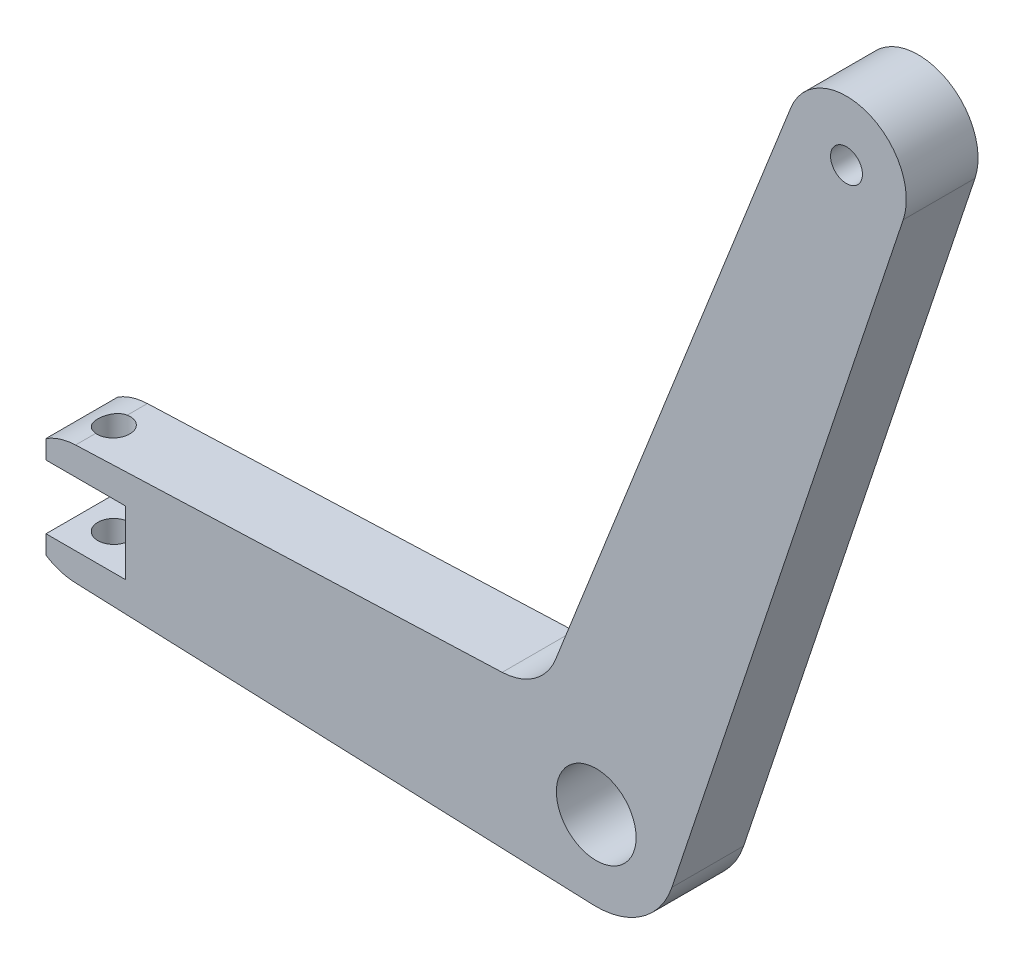
from build123d import *

# Parameters (mm, degrees)
EXTRUDE_1_DEPTH     = 18
SKETCH_3_R          = 10
SKETCH_3_R_2        = 4
CUT_EXTRUDE_1_DEPTH = 18
SKETCH_4_R          = 4
CUT_EXTRUDE_2_DEPTH = 20
CUT_EXTRUDE_START   = 12
SKETCH_5_W          = 18
SKETCH_5_H          = 16
CUT_EXTRUDE_3_DEPTH = 28
CUT_EXTRUDE_5_DEPTH = 18


with BuildPart() as part:
    # 草图1 → 凸台-拉伸1 (new body)
    with BuildSketch(Plane.XY):
        with BuildLine():
            Line((76.990642, 167.689269), (18.973261, -6.325769))
            ThreePointArc((18.973261, -6.325769), (11.378738, -16.447623), (-0.770942, -19.985136))
            Line((-0.770942, -19.985136), (-130.000001, -15.000028))
            ThreePointArc((-130.000001, -15.000028), (-144.997254, -0.288514), (-130.576922, 14.988929))
            Line((-130.576922, 14.988929), (-23.583521, 19.107084))
            ThreePointArc((-23.583521, 19.107084), (-15.488001, 21.857162), (-10.210075, 28.583518))
            Line((-10.210075, 28.583518), (48.810331, 177.946064))
            ThreePointArc((48.810331, 177.946064), (67.890998, 186.528985), (76.990642, 167.689269))
        make_face()
    extrude(amount=EXTRUDE_1_DEPTH)

    # 草图3 → 切除-拉伸1 (cut)
    with BuildSketch(Plane.XY):
        Circle(SKETCH_3_R)
        with Locations((62.760696, 172.433596)):
            Circle(SKETCH_3_R_2)
    extrude(amount=CUT_EXTRUDE_1_DEPTH, mode=Mode.SUBTRACT)

    # 草图4 → 切除-拉伸2 (cut, symmetric)
    with BuildSketch(Plane(origin=(0, 0, 0), x_dir=(1, 0, 0), z_dir=(0, 1, 0))):
        with Locations(Location((-130, -9, 0), (0, 0, 269.999985))):
            Circle(SKETCH_4_R)
    extrude(amount=CUT_EXTRUDE_2_DEPTH, both=True, mode=Mode.SUBTRACT)

    # 草图5 → 切除-拉伸3 (cut)
    with BuildSketch(Plane(origin=(-130, 0, 0), x_dir=(0, 0, -1), z_dir=(1, 0, 0)).offset(CUT_EXTRUDE_START)):
        with Locations((-9, 0)):
            Rectangle(SKETCH_5_W, SKETCH_5_H)
    extrude(amount=-CUT_EXTRUDE_3_DEPTH, mode=Mode.SUBTRACT)

    # 草图8 → 切除-拉伸5 (cut)
    with BuildSketch(Plane.XY):
        Polygon((-145.000001, 0), (-145.000001, 20), (-138.000001, 20), (-138.000001, -20), (-145.000001, -20), align=None)
    extrude(amount=CUT_EXTRUDE_5_DEPTH, mode=Mode.SUBTRACT)


solid = part.part
